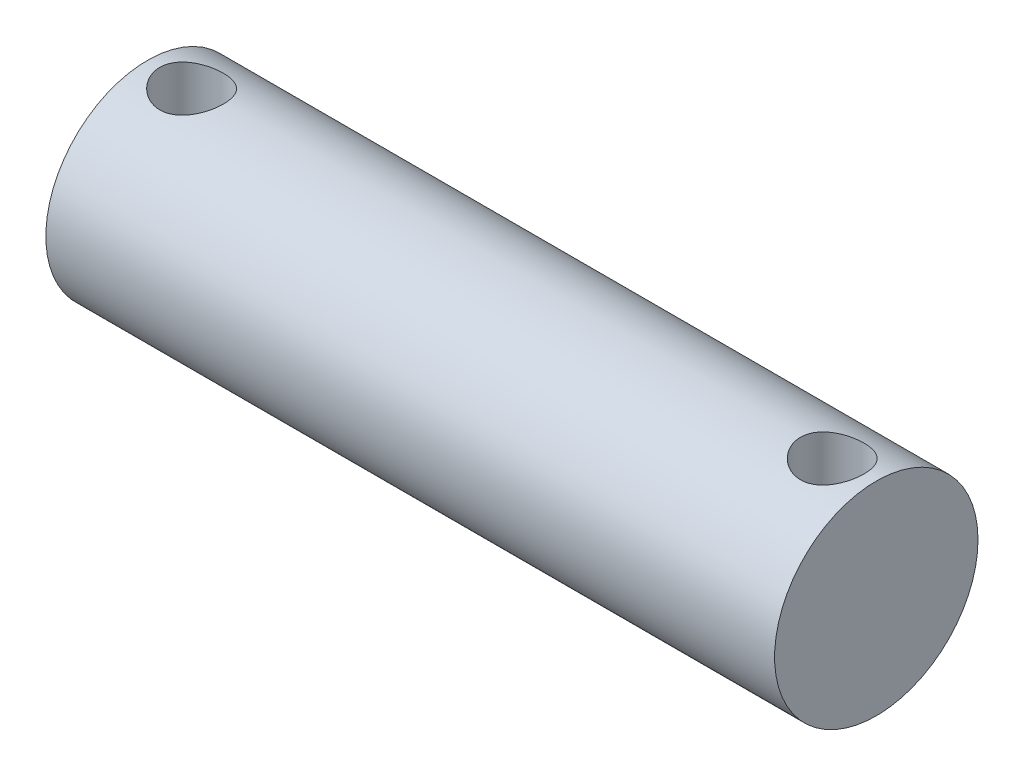
from build123d import *

# Parameters (mm, degrees)
CROQUIS1_R              = 12.7
SALIENTE_EXTRUIR1_DEPTH = 91
CROQUIS2_R              = 3.96875
CORTAR_EXTRUIR1_DEPTH   = 20


with BuildPart() as part:
    # Croquis1 → Saliente-Extruir1 (new body)
    with BuildSketch(Plane(origin=(0, 0, 0), x_dir=(0, 0, -1), z_dir=(1, 0, 0))):
        Circle(CROQUIS1_R)
    extrude(amount=SALIENTE_EXTRUIR1_DEPTH)

    # Croquis2 → Cortar-Extruir1 (cut, symmetric)
    with BuildSketch(Plane(origin=(0, 0, 0), x_dir=(1, 0, 0), z_dir=(0, 1, 0))):
        with Locations(Location((5.5, 0, 0), (0, 0, 270))):
            Circle(CROQUIS2_R)
        with Locations(Location((85.5, 0, 0), (0, 0, 270))):
            Circle(CROQUIS2_R)
    extrude(amount=CORTAR_EXTRUIR1_DEPTH, both=True, mode=Mode.SUBTRACT)


solid = part.part
